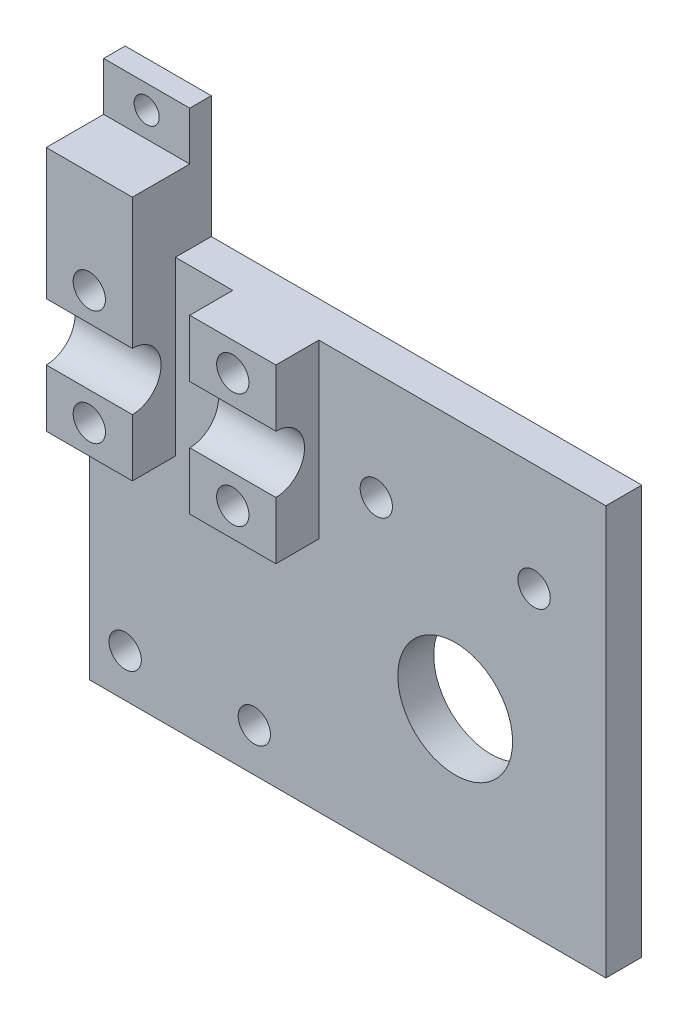
from build123d import *

# Parameters (mm, degrees)
SKETCH1_W           = 72
SKETCH1_H           = 57
BOSS_EXTRUDE1_DEPTH = 5
BOSS_EXTRUDE2_DEPTH = 12
SKETCH5_R           = 2.25
CUT_EXTRUDE2_DEPTH  = 64.790673299
SKETCH4_R           = 8
CUT_EXTRUDE1_DEPTH  = 64.120915709
SKETCH6_R           = 2.25
CUT_EXTRUDE3_DEPTH  = 64.120915709
SKETCH7_R           = 2.25
CUT_EXTRUDE4_DEPTH  = 64.120915709
SKETCH8_R           = 1.75
BOSS_EXTRUDE3_DEPTH = 3
SKETCH9_W           = 12
SKETCH9_H           = 10.25
BOSS_EXTRUDE4_DEPTH = 8


with BuildPart() as part:
    # Sketch1 → Boss-Extrude1 (new body)
    with BuildSketch(Plane.XY):
        with Locations((20, 0)):
            Rectangle(SKETCH1_W, SKETCH1_H)
    extrude(amount=BOSS_EXTRUDE1_DEPTH)

    # Sketch3 → Boss-Extrude2 (add)
    with BuildSketch(Plane(origin=(-16, 0, 0), x_dir=(0, 0, -1), z_dir=(1, 0, 0))):
        with BuildLine():
            Line((-5, 28.5), (-11, 28.5))
            Line((-11, 28.5), (-11, 20.5))
            ThreePointArc((-11, 20.5), (-7, 16.5), (-11, 12.5))
            Line((-11, 12.5), (-11, 4.5))
            Line((-11, 4.5), (-5, 4.5))
            Line((-5, 4.5), (-5, 28.5))
        make_face()
    boss_extrude2 = extrude(amount=BOSS_EXTRUDE2_DEPTH)

    # Sketch5 → Cut-Extrude2 (cut, through all)
    with BuildSketch(Plane.XY.offset(11)):
        with Locations((-10, 24.5)):
            Circle(SKETCH5_R)
        with Locations((-10, 8.5)):
            Circle(SKETCH5_R)
    cut_extrude2 = extrude(amount=-CUT_EXTRUDE2_DEPTH, mode=Mode.SUBTRACT)

    # Mirror1: Boss-Extrude2, Cut-Extrude2 across plane
    add(boss_extrude2.mirror(Plane(origin=(0, 0, 0), x_dir=(0, 0, 1), z_dir=(1, 0, 0))))
    add(cut_extrude2.mirror(Plane(origin=(0, 0, 0), x_dir=(0, 0, 1), z_dir=(1, 0, 0))), mode=Mode.SUBTRACT)

    # Sketch4 → Cut-Extrude1 (cut, through all)
    with BuildSketch(Plane.XY.offset(5)):
        with Locations((35, -6.5)):
            Circle(SKETCH4_R)
    extrude(amount=-CUT_EXTRUDE1_DEPTH, mode=Mode.SUBTRACT)

    # Sketch6 → Cut-Extrude3 (cut, through all)
    with BuildSketch(Plane.XY.offset(5)):
        with Locations((-11, -22.5)):
            Circle(SKETCH6_R)
        with Locations((7, -22.5)):
            Circle(SKETCH6_R)
    extrude(amount=-CUT_EXTRUDE3_DEPTH, mode=Mode.SUBTRACT)

    # Sketch7 → Cut-Extrude4 (cut, through all)
    with BuildSketch(Plane.XY.offset(5)):
        with Locations((46, 13.5)):
            Circle(SKETCH7_R)
        with Locations((24, 13.5)):
            Circle(SKETCH7_R)
    extrude(amount=-CUT_EXTRUDE4_DEPTH, mode=Mode.SUBTRACT)

    # Sketch8 → Boss-Extrude3 (add)
    with BuildSketch(Plane(origin=(0, 0, 0), x_dir=(-1, 0, 0), z_dir=(0, 0, -1))):
        Polygon((16, 39), (16, 45.5), (4, 45.5), (4, 39), (4, 28.5), (16, 28.5), align=None)
        with Locations((10, 42.25)):
            Circle(SKETCH8_R, mode=Mode.SUBTRACT)
    extrude(amount=-BOSS_EXTRUDE3_DEPTH)

    # Sketch9 → Boss-Extrude4 (add)
    with BuildSketch(Plane.XY.offset(3)):
        with Locations((-10, 33.625)):
            Rectangle(SKETCH9_W, SKETCH9_H)
    extrude(amount=BOSS_EXTRUDE4_DEPTH)


solid = part.part
